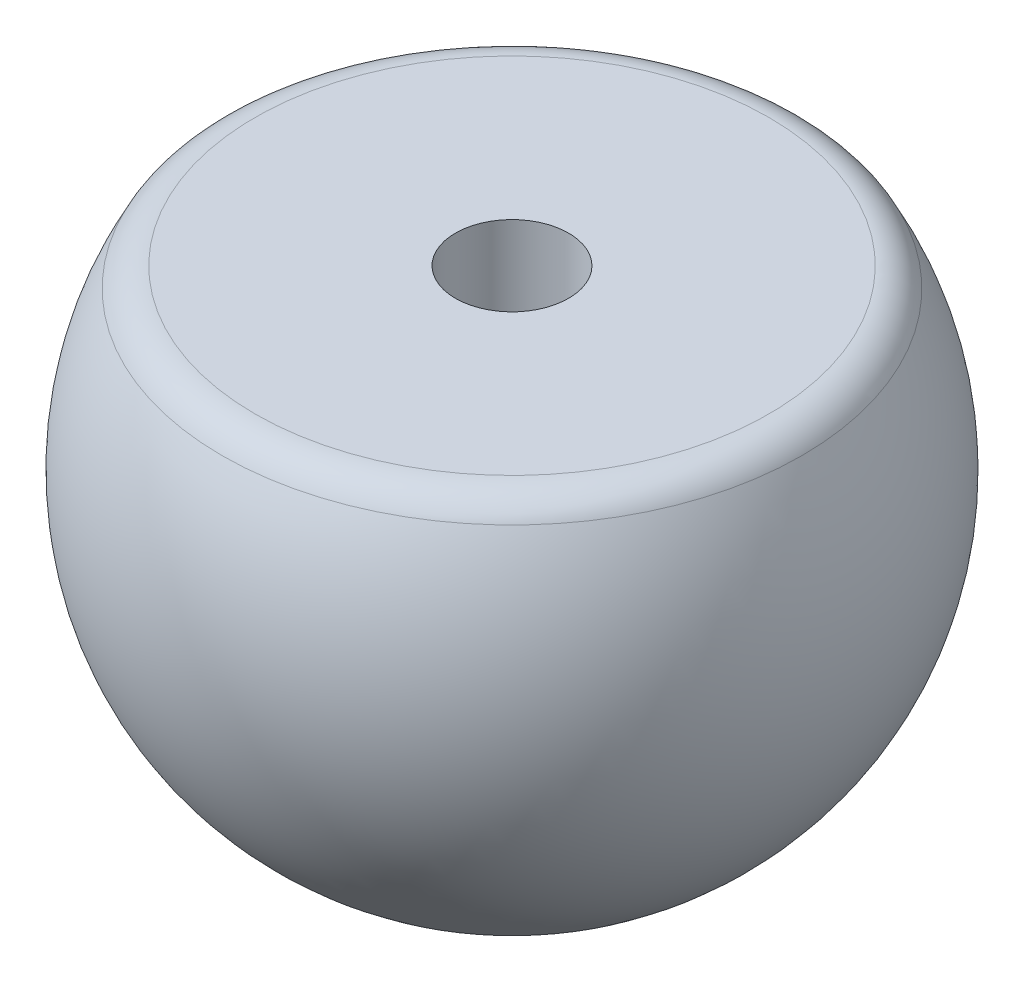
from build123d import *

# Parameters (mm, degrees)
CUT_EXTRUDE_1_DEPTH      = 19.987901745
CUT_EXTRUDE_1_DEPTH_BACK = 19.987901745
SKETCH_2_R               = 1.51
SKETCH_4_R               = 4.643686352
CUT_EXTRUDE_2_DEPTH      = 5
SKETCH_5_R               = 3.676903301
CUT_EXTRUDE_3_DEPTH      = 3
FILLET_1_R               = 1


with BuildPart() as part:
    # 草图1 → 旋转1 (revolve)
    with BuildSketch(Plane.XY):
        with BuildLine():
            Line((-1.222258531, -6.073377549), (-1.222258531, 7.441604752))
            Line((-1.222258531, 7.441604752), (-8.652530525, 7.441604752))
            ThreePointArc((-8.652530525, 7.441604752), (-8.933673585, -1.512962184), (-1.222258531, -6.073377549))
        make_face()
    revolve(axis=Axis((-1.222258531, 5.226622451, 0), (0, -1, 0)))

    # 草图2 → 切除-拉伸1 (cut, two sides: drawn at the far end of the back side and taken through both)
    with BuildSketch(Plane(origin=(0, 7.441604752, 0), x_dir=(1, 0, 0), z_dir=(0, 1, 0)).offset(-CUT_EXTRUDE_1_DEPTH_BACK)):
        with Locations(Location((-1.222258531, 0, 0), (0, 0, 270))):
            Circle(SKETCH_2_R)
    extrude(amount=CUT_EXTRUDE_1_DEPTH + CUT_EXTRUDE_1_DEPTH_BACK, mode=Mode.SUBTRACT)

    # 草图4 → 切除-拉伸2 (cut)
    with BuildSketch(Plane(origin=(0, -10, 0), x_dir=(1, 0, 0), z_dir=(0, 1, 0))):
        with Locations((-1.222258531, 0)):
            Circle(SKETCH_4_R)
    extrude(amount=CUT_EXTRUDE_2_DEPTH, mode=Mode.SUBTRACT)

    # 草图5 → 切除-拉伸3 (cut)
    with BuildSketch(Plane.XZ.offset(5)):
        with Locations(Location((-1.222258531, 0, 0), (0, 0, 270))):
            Circle(SKETCH_5_R)
    extrude(amount=-CUT_EXTRUDE_3_DEPTH, mode=Mode.SUBTRACT)

    # 圆角1
    fillet_1_edges = [part.edges().sort_by_distance(p)[0] for p in [
        (6.208013462, 7.441604752, 0),
    ]]
    fillet(fillet_1_edges, radius=FILLET_1_R)


solid = part.part
